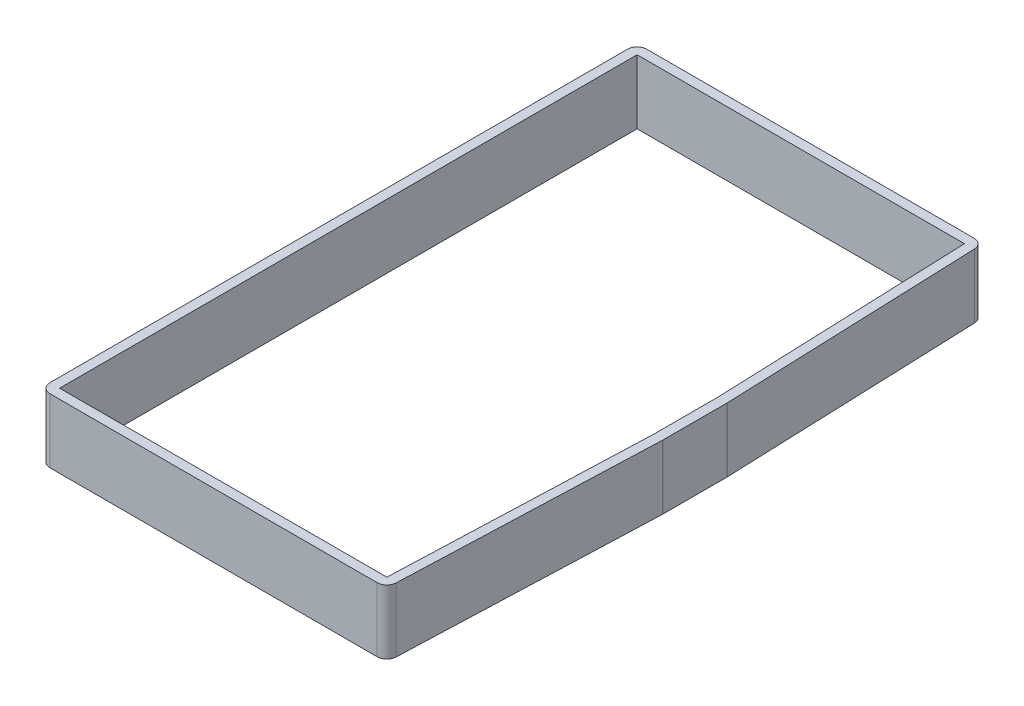
from build123d import *

# Parameters (mm, degrees)
EXTRUDE_THIN1_DEPTH = 10
FILLET1_R           = 3


with BuildPart() as part:
    # Sketch1 → Extrude-Thin1 (new, symmetric)
    with BuildSketch(Plane(origin=(0, 0, 0), x_dir=(1, 0, 0), z_dir=(0, 1, 0))):
        Polygon((57, 10.056230239), (57, -10.056230239), (53.889608634, -93), (-54, -93), (-54, 93), (53.889608634, 93), align=None)
        Polygon((54, 10), (54, -10), (51, -90), (-51, -90), (-51, 90), (51, 90), align=None, mode=Mode.SUBTRACT)
    extrude(amount=EXTRUDE_THIN1_DEPTH, both=True)

    # Fillet1
    fillet1_edges = [part.edges().sort_by_distance(p)[0] for p in [
        (57, 0, 10.056230239),
        (53.889608634, 0, 93),
        (-54, 0, 93),
        (-54, 0, -93),
        (53.889608634, 0, -93),
        (57, 0, -10.056230239),
    ]]
    fillet(fillet1_edges, radius=FILLET1_R)


solid = part.part
